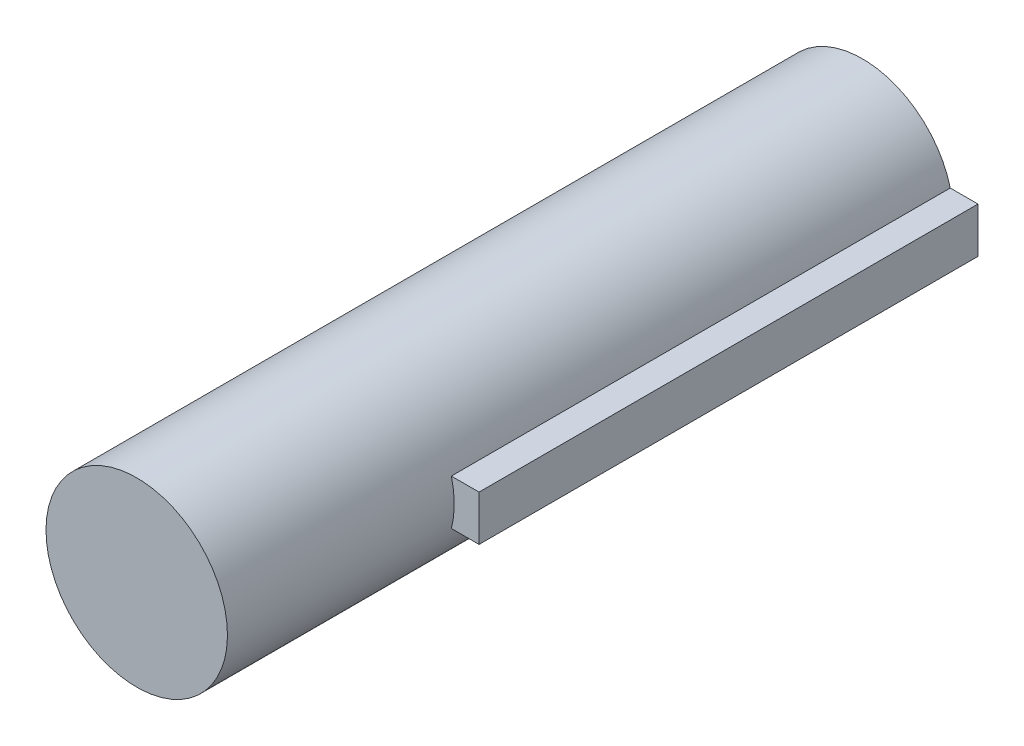
from build123d import *

# Parameters (mm, degrees)
SKETCH1_R           = 20
BOSS_EXTRUDE1_DEPTH = 160
BOSS_EXTRUDE2_DEPTH = 110


with BuildPart() as part:
    # Sketch1 → Boss-Extrude1 (new body)
    with BuildSketch(Plane.XY):
        Circle(SKETCH1_R)
    extrude(amount=BOSS_EXTRUDE1_DEPTH)

    # Sketch2 → Boss-Extrude2 (add)
    with BuildSketch(Plane(origin=(0, 0, 0), x_dir=(-1, 0, 0), z_dir=(0, 0, -1))):
        with BuildLine():
            Line((-19.364916731, 5), (-25.478218102, 5))
            Line((-25.478218102, 5), (-25.478218102, -5))
            Line((-25.478218102, -5), (-19.364916731, -5))
            ThreePointArc((-19.364916731, -5), (-20, 0), (-19.364916731, 5))
        make_face()
    extrude(amount=-BOSS_EXTRUDE2_DEPTH)


solid = part.part
